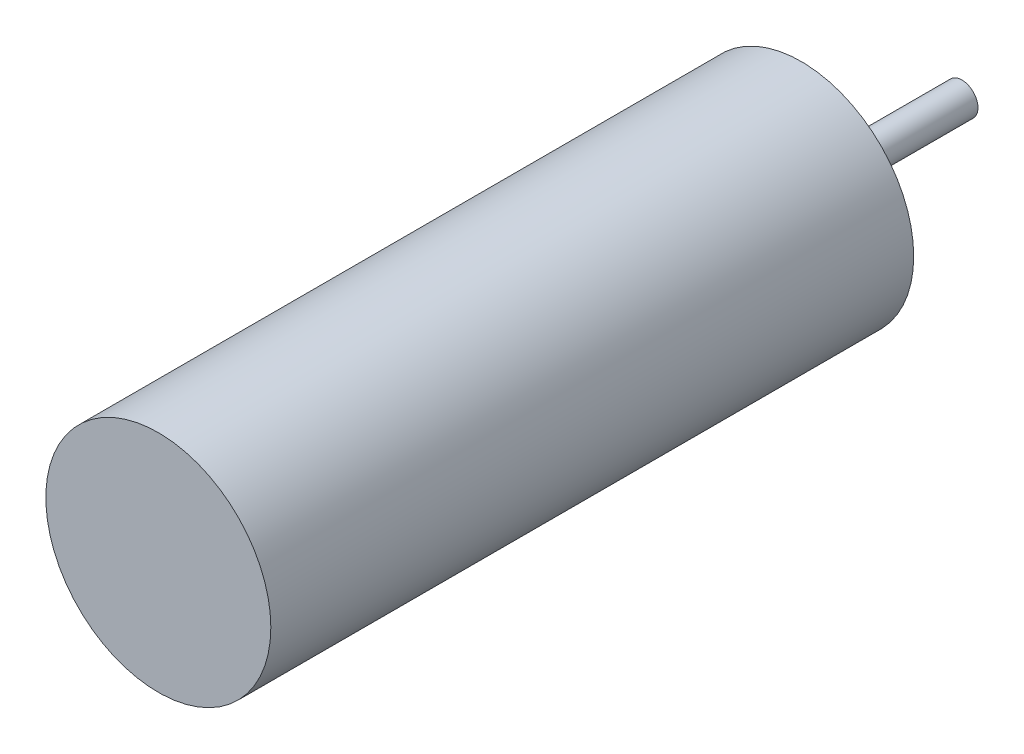
from build123d import *

# Parameters (mm, degrees)
ESQUISSE1_R        = 3.5
BOSS_EXTRU_1_DEPTH = 20
ESQUISSE2_R        = 0.5
BOSS_EXTRU_2_DEPTH = 5


with BuildPart() as part:
    # Esquisse1 → Boss.-Extru.1 (new body)
    with BuildSketch(Plane.XY):
        Circle(ESQUISSE1_R)
    extrude(amount=BOSS_EXTRU_1_DEPTH)

    # Esquisse2 → Boss.-Extru.2 (add)
    with BuildSketch(Plane(origin=(0, 0, 0), x_dir=(-1, 0, 0), z_dir=(0, 0, -1))):
        with Locations(Location((0, 0, 0), (0, 0, 180))):
            Circle(ESQUISSE2_R)
    extrude(amount=BOSS_EXTRU_2_DEPTH)


solid = part.part
